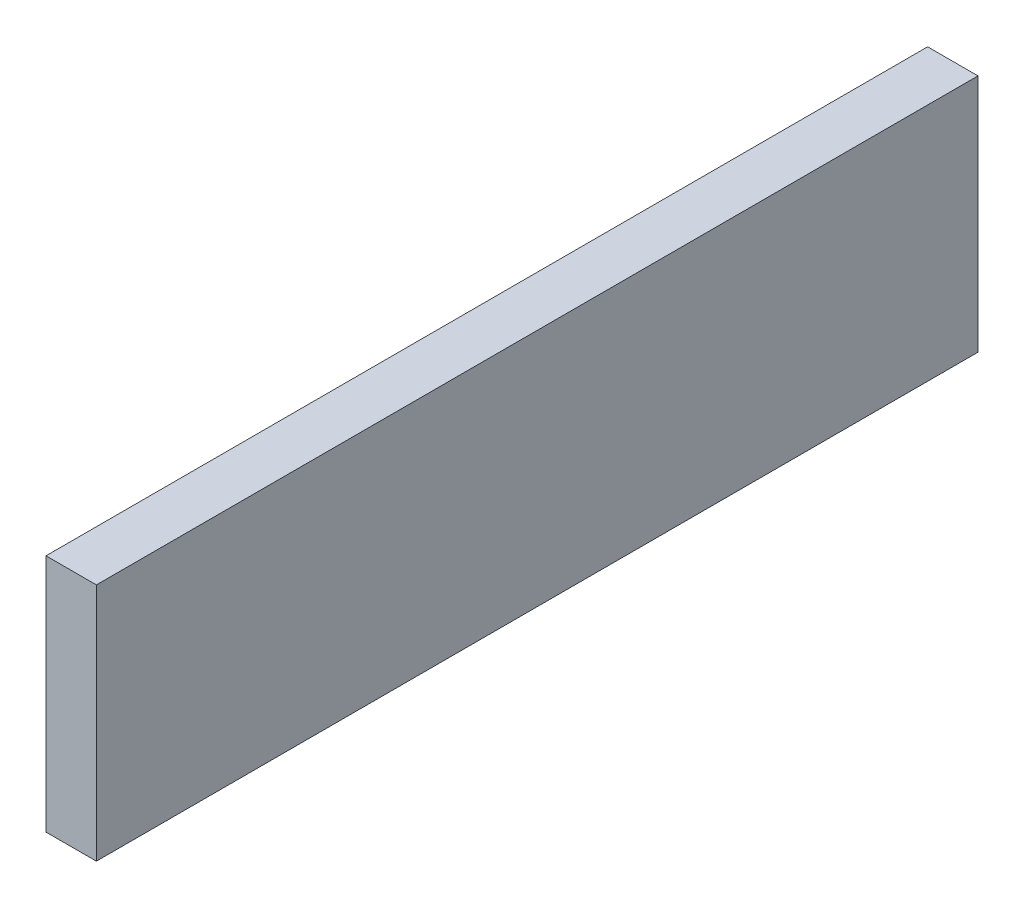
from build123d import *

# Parameters (mm, degrees)
SKETCH1_W      = 25.4
SKETCH1_H      = 120.65
EXTRUDE1_DEPTH = 444.5


with BuildPart() as part:
    # Sketch1 → Extrude1 (new body)
    with BuildSketch(Plane.XY):
        with Locations((0, 60.325)):
            Rectangle(SKETCH1_W, SKETCH1_H)
    extrude(amount=-EXTRUDE1_DEPTH)


solid = part.part
